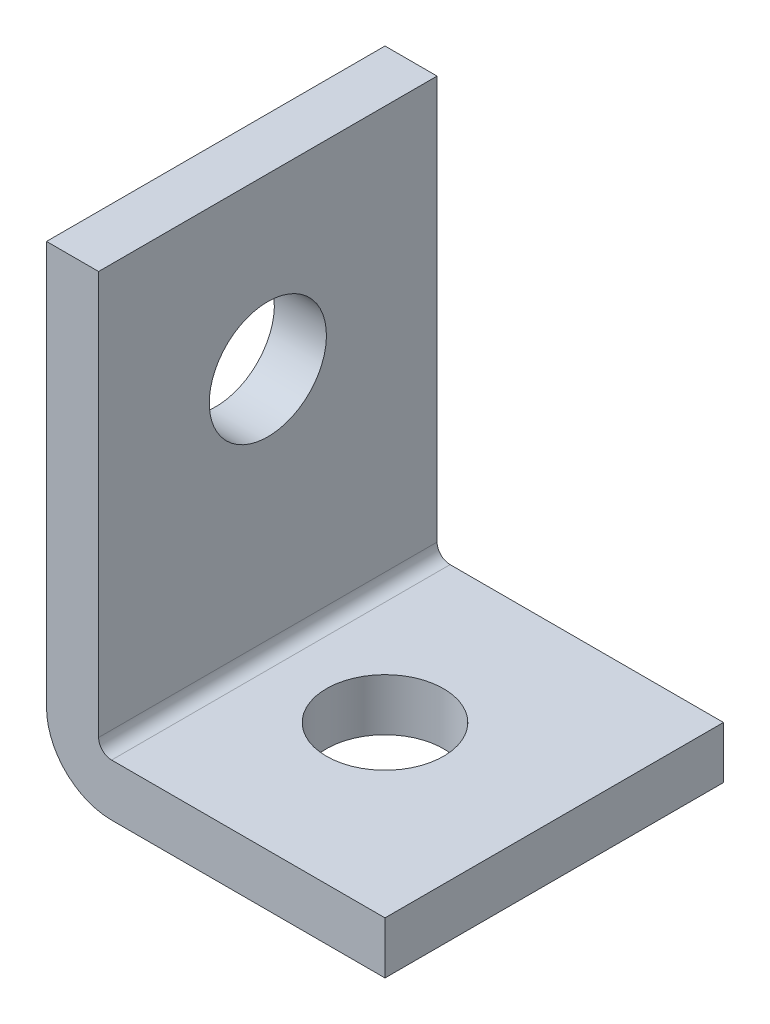
from build123d import *

# Parameters (mm, degrees)
EXTRUDE_THIN1_DEPTH = 20.6375
SKETCH2_R           = 7.14375
CUT_EXTRUDE1_DEPTH  = 69.63069307
SKETCH3_R           = 7.14375
CUT_EXTRUDE2_DEPTH  = 71.084124673


with BuildPart() as part:
    # Sketch1 → Extrude-Thin1 (new, symmetric)
    with BuildSketch(Plane.XY):
        with BuildLine():
            Line((0, 57.15), (0, 7.9375))
            ThreePointArc((0, 7.9375), (2.324839924, 2.324839924), (7.9375, 0))
            Line((7.9375, 0), (41.275, 0))
            Line((41.275, 0), (41.275, 6.35))
            Line((41.275, 6.35), (7.9375, 6.35))
            ThreePointArc((7.9375, 6.35), (6.814967985, 6.814967985), (6.35, 7.9375))
            Line((6.35, 7.9375), (6.35, 57.15))
            Line((6.35, 57.15), (0, 57.15))
        make_face()
    extrude(amount=EXTRUDE_THIN1_DEPTH, both=True)

    # Sketch2 → Cut-Extrude1 (cut, through all)
    with BuildSketch(Plane(origin=(0, 6.35, 0), x_dir=(1, 0, 0), z_dir=(0, 1, 0))):
        with Locations(Location((20.6375, 0, 0), (0, 0, 270))):
            Circle(SKETCH2_R)
    extrude(amount=-CUT_EXTRUDE1_DEPTH, mode=Mode.SUBTRACT)

    # Sketch3 → Cut-Extrude2 (cut, through all)
    with BuildSketch(Plane(origin=(6.35, 0, 0), x_dir=(0, 0, -1), z_dir=(1, 0, 0))):
        with Locations(Location((0, 36.5125, 0), (0, 0, 90))):
            Circle(SKETCH3_R)
    extrude(amount=-CUT_EXTRUDE2_DEPTH, mode=Mode.SUBTRACT)


solid = part.part
